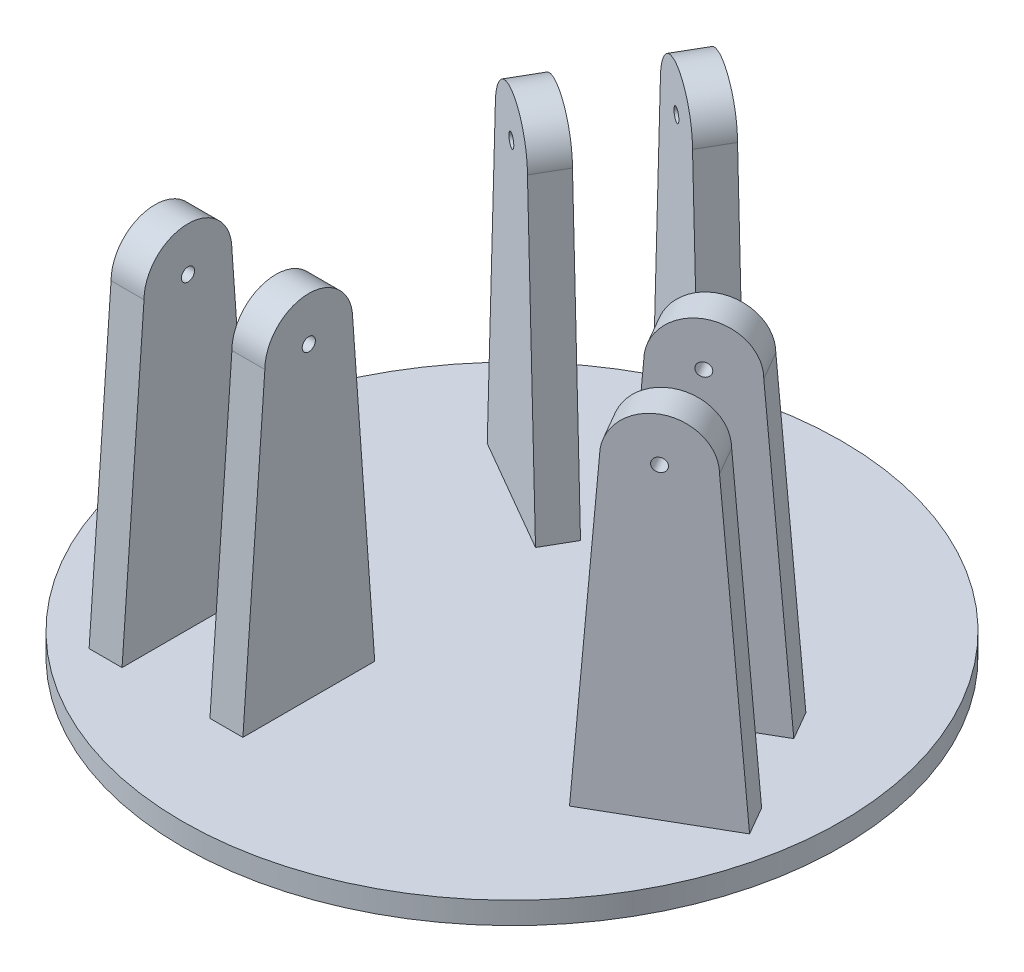
from build123d import *

# Parameters (mm, degrees)
SKETCH2_R          = 75
EXTRUDE1_DEPTH     = 5
EXTRUDE3_START     = 5
SKETCH1_W          = 7.5
SKETCH1_H          = 30
EXTRUDE3_DEPTH     = 80
SKETCH3_R          = 1.5
CUT_EXTRUDE1_DEPTH = 55
CIRPATTERN1_COUNT  = 3


with BuildPart() as part:
    # Sketch2 → Extrude1 (new body)
    with BuildSketch(Plane(origin=(0, 0, 0), x_dir=(1, 0, 0), z_dir=(0, 1, 0))):
        with Locations(Location((0, 0, 0), (0, 0, 270))):
            Circle(SKETCH2_R)
    extrude(amount=EXTRUDE1_DEPTH)

    # Sketch1 → Extrude3 (add)
    with BuildSketch(Plane(origin=(0, 0, 0), x_dir=(1, 0, 0), z_dir=(0, 1, 0)).offset(EXTRUDE3_START)):
        with Locations((-13.439285714, -36.554084254)):
            Rectangle(SKETCH1_W, SKETCH1_H)
        with Locations((-40.939285714, -36.554084254)):
            Rectangle(SKETCH1_W, SKETCH1_H)
    extrude3 = extrude(amount=EXTRUDE3_DEPTH)

    # Sketch3 → Cut-Extrude1 (cut)
    with BuildSketch(Plane(origin=(0, 0, 0), x_dir=(0, 0, -1), z_dir=(1, 0, 0))):
        with Locations((-36.554084254, 75)):
            Circle(SKETCH3_R)
        with BuildLine():
            Line((-51.554084254, 5), (-52.554084254, 6))
            Line((-52.554084254, 6), (-52.554084254, 86))
            Line((-52.554084254, 86), (-20.554084254, 86))
            Line((-20.554084254, 86), (-20.554084254, 6))
            Line((-20.554084254, 6), (-21.554084254, 5))
            Line((-21.554084254, 5), (-26.554084254, 75))
            ThreePointArc((-26.554084254, 75), (-36.554084254, 85), (-46.554084254, 75))
            Line((-46.554084254, 75), (-51.554084254, 5))
        make_face()
    cut_extrude1 = extrude(amount=-CUT_EXTRUDE1_DEPTH, mode=Mode.SUBTRACT)

    # CirPattern1: Extrude3, Cut-Extrude1 ×3 about axis
    cirpattern1_axis = Axis((0, 0, 0), (0, 1, 0))
    add([extrude3.rotate(cirpattern1_axis, i * 360 / CIRPATTERN1_COUNT) for i in range(1, CIRPATTERN1_COUNT)])
    add([cut_extrude1.rotate(cirpattern1_axis, i * 360 / CIRPATTERN1_COUNT) for i in range(1, CIRPATTERN1_COUNT)], mode=Mode.SUBTRACT)


solid = part.part
